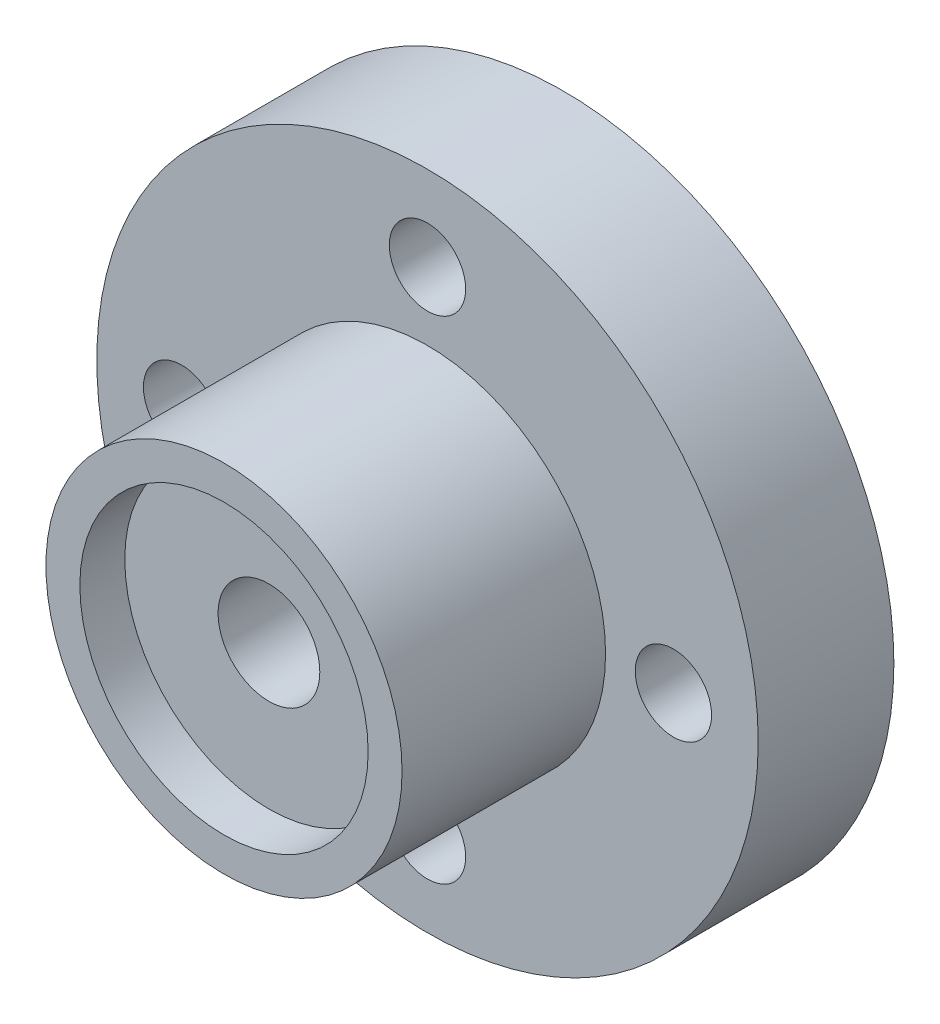
from build123d import *

# Parameters (mm, degrees)
SKETCH_1_R               = 19.5
EXTRUDE_1_DEPTH          = 8
SKETCH_2_R               = 10.5
EXTRUDE_2_DEPTH          = 12
SKETCH_3_R               = 3
CUT_EXTRUDE_1_DEPTH      = 35.066112194
SKETCH_4_R               = 8.5
CUT_EXTRUDE_3_DEPTH      = 2.65
CUT_EXTRUDE_START        = -2
SKETCH_5_R               = 8.5
CUT_EXTRUDE_4_DEPTH      = 2
PATTERN_CIRCULAR_1_COUNT = 4


with BuildPart() as part:
    # 草图1 → 凸台-拉伸1 (new body)
    with BuildSketch(Plane.XY):
        Circle(SKETCH_1_R)
    extrude(amount=EXTRUDE_1_DEPTH)

    # 草图2 → 凸台-拉伸2 (add)
    with BuildSketch(Plane.XY.offset(8)):
        Circle(SKETCH_2_R)
    extrude(amount=EXTRUDE_2_DEPTH)

    # 草图3 → 切除-拉伸1 (cut, through all)
    with BuildSketch(Plane(origin=(0, 0, 0), x_dir=(-1, 0, 0), z_dir=(0, 0, -1))):
        Circle(SKETCH_3_R)
    extrude(amount=-CUT_EXTRUDE_1_DEPTH, mode=Mode.SUBTRACT)

    # 草图4 → 切除-拉伸3 (cut)
    with BuildSketch(Plane.XY.offset(20)):
        Circle(SKETCH_4_R)
    extrude(amount=-CUT_EXTRUDE_3_DEPTH, mode=Mode.SUBTRACT)

    # 草图5 → 切除-拉伸4 (cut)
    with BuildSketch(Plane(origin=(0, 0, 0), x_dir=(-1, 0, 0), z_dir=(0, 0, -1)).offset(CUT_EXTRUDE_START)):
        with Locations(Location((0, 0, 0), (0, 0, 180))):
            Circle(SKETCH_5_R)
    extrude(amount=CUT_EXTRUDE_4_DEPTH, mode=Mode.SUBTRACT)

    # 草图7 → M4 六角圆柱头螺钉的柱形沉头孔1 (revolve, cut)
    with BuildSketch(Plane(origin=(0, 14.5, 0), x_dir=(0, 1, 0), z_dir=(1, 0, 0))):
        Polygon((0, 0), (0, 20), (2.25, 20), (2.25, 4.6), (4, 4.6), (4, 0.025), (4.025, 0), align=None)
    hole_wizard_m4_1 = revolve(axis=Axis((0, 14.5, -6.35), (0, 0, 1)), mode=Mode.SUBTRACT)

    # 阵列(圆周)1: M4 六角圆柱头螺钉的柱形沉头孔1 ×4 about axis
    pattern_circular_1_axis = Axis((0, 0, 0), (0, 0, 1))
    for i in range(1, PATTERN_CIRCULAR_1_COUNT):
        add(hole_wizard_m4_1.rotate(pattern_circular_1_axis, i * 360 / PATTERN_CIRCULAR_1_COUNT), mode=Mode.SUBTRACT)


solid = part.part
